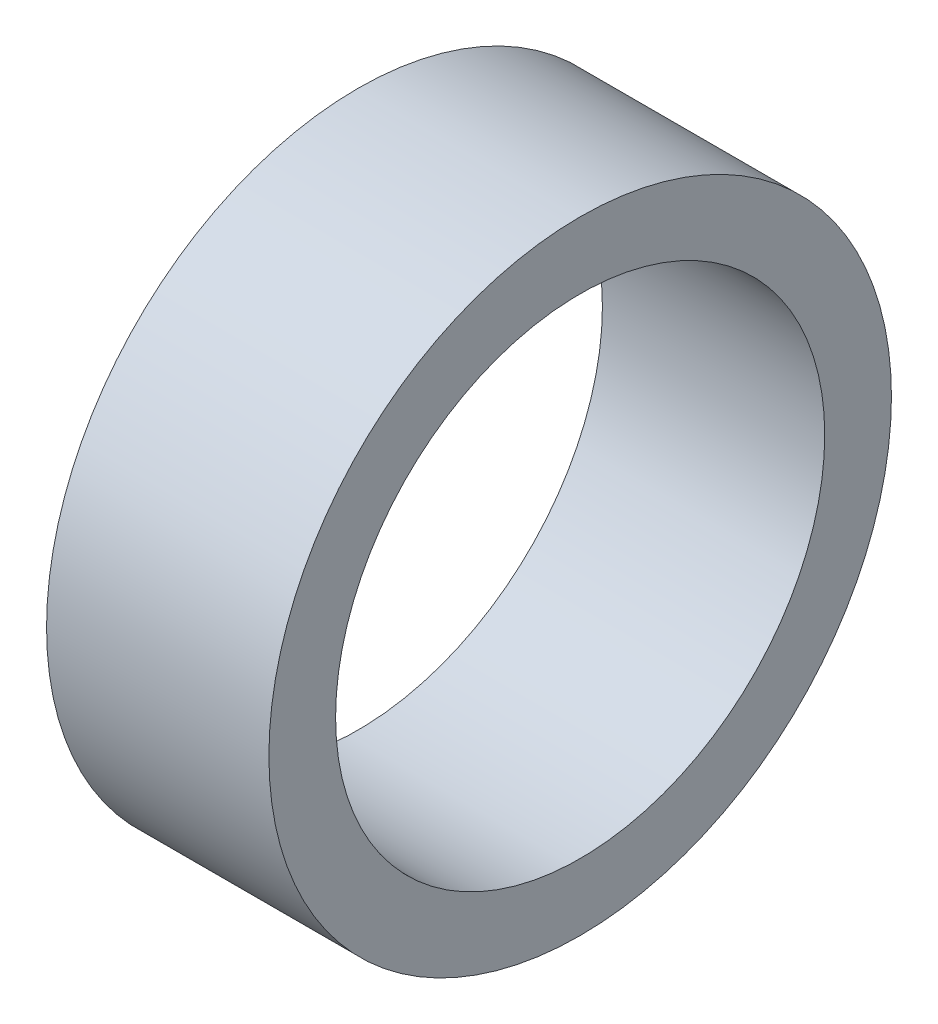
from build123d import *

# Parameters (mm, degrees)
SKETCH1_R           = 4.445
SKETCH1_R_2         = 3.4925
BOSS_EXTRUDE1_DEPTH = 3.175


with BuildPart() as part:
    # Sketch1 → Boss-Extrude1 (new body)
    with BuildSketch(Plane(origin=(0, 0, 0), x_dir=(0, 0, -1), z_dir=(1, 0, 0))):
        Circle(SKETCH1_R)
        Circle(SKETCH1_R_2, mode=Mode.SUBTRACT)
    extrude(amount=BOSS_EXTRUDE1_DEPTH)


solid = part.part
